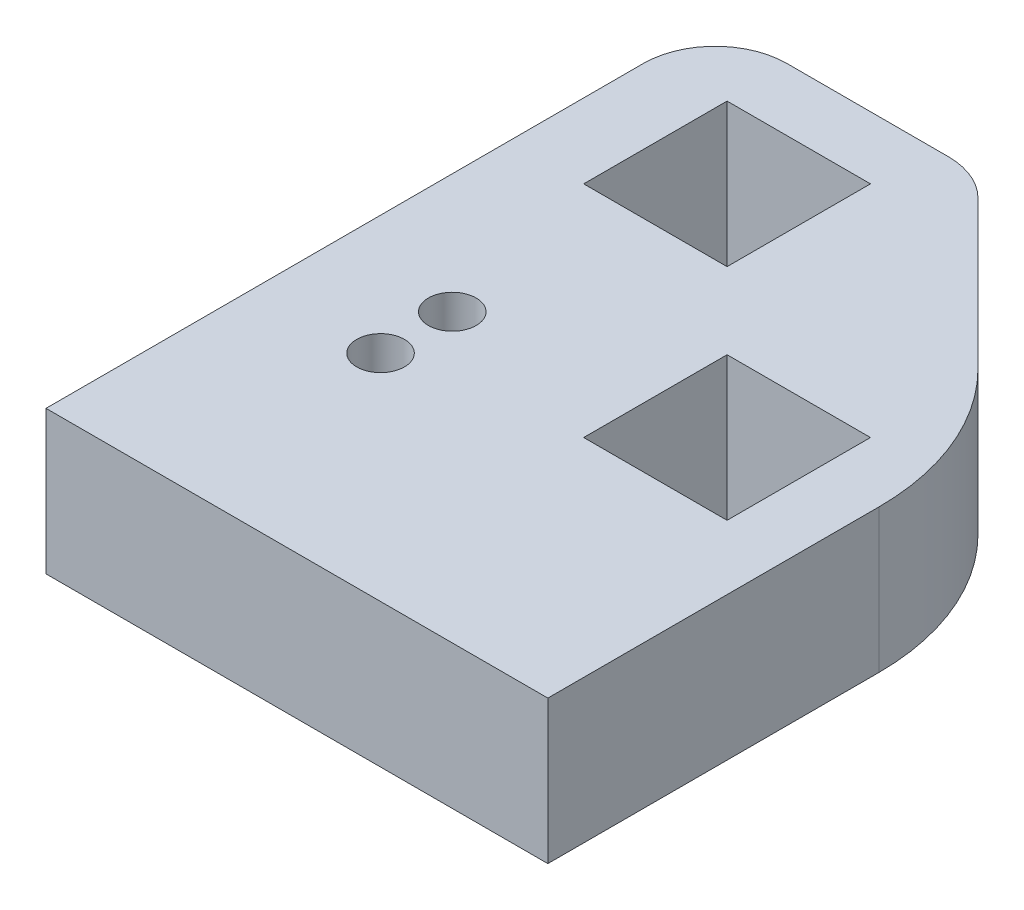
from build123d import *

# Parameters (mm, degrees)
BOSS_EXTRUDE1_DEPTH = 6
SKETCH2_W           = 5
SKETCH2_H           = 5
CUT_EXTRUDE1_DEPTH  = 40.357337308
CUT_EXTRUDE2_DEPTH  = 40.357337308
SKETCH6_W           = 6
SKETCH6_H           = 6
CUT_EXTRUDE5_DEPTH  = 36.510561809
FILLET1_R           = 10
FILLET2_R           = 3
SKETCH5_R           = 1
CUT_EXTRUDE3_DEPTH  = 36.510561809


with BuildPart() as part:
    # Sketch1 → Boss-Extrude1 (new body)
    with BuildSketch(Plane(origin=(0, 0, 0), x_dir=(1, 0, 0), z_dir=(0, 1, 0))):
        Polygon((21, 0), (21, 9), (27, 9), (27, 28), (0, 28), (0, 0), align=None)
    extrude(amount=BOSS_EXTRUDE1_DEPTH)

    # Sketch2 → Cut-Extrude1 (cut, through all)
    with BuildSketch(Plane(origin=(0, 6, 0), x_dir=(1, 0, 0), z_dir=(0, 1, 0))):
        with Locations((5.615223689, 22.884776311)):
            Rectangle(SKETCH2_W, SKETCH2_H)
        with Locations((14.807611845, 13.692388155)):
            Rectangle(SKETCH2_W, SKETCH2_H)
    extrude(amount=-CUT_EXTRUDE1_DEPTH, mode=Mode.SUBTRACT)

    # Sketch3 → Cut-Extrude2 (cut, through all)
    with BuildSketch(Plane(origin=(0, 6, 0), x_dir=(1, 0, 0), z_dir=(0, 1, 0))):
        Polygon((21, 18), (11, 28), (33.43673633, 34.250964333), (36.08047681, 3.383507916), (21, 9), align=None)
    extrude(amount=-CUT_EXTRUDE2_DEPTH, mode=Mode.SUBTRACT)

    # Sketch6 → Cut-Extrude5 (cut, through all)
    with BuildSketch(Plane(origin=(0, 6, 0), x_dir=(1, 0, 0), z_dir=(0, 1, 0))):
        with Locations((6.115223689, 22.384776311)):
            Rectangle(SKETCH6_W, SKETCH6_H)
        with Locations((15.307611845, 13.192388155)):
            Rectangle(SKETCH6_W, SKETCH6_H)
    extrude(amount=-CUT_EXTRUDE5_DEPTH, mode=Mode.SUBTRACT)

    # Fillet1
    fillet1_edges = [part.edges().sort_by_distance(p)[0] for p in [
        (21, 3, -18),
    ]]
    fillet(fillet1_edges, radius=FILLET1_R)

    # Fillet2
    fillet2_edges = [part.edges().sort_by_distance(p)[0] for p in [
        (0, 3, -28),
        (11, 3, -28),
    ]]
    fillet(fillet2_edges, radius=FILLET2_R)

    # Sketch5 → Cut-Extrude3 (cut, through all)
    with BuildSketch(Plane(origin=(0, 6, 0), x_dir=(1, 0, 0), z_dir=(0, 1, 0))):
        with Locations(Location((5, 12, 0), (0, 0, 270))):
            Circle(SKETCH5_R)
        with Locations(Location((5, 9, 0), (0, 0, 270))):
            Circle(SKETCH5_R)
    extrude(amount=-CUT_EXTRUDE3_DEPTH, mode=Mode.SUBTRACT)


solid = part.part
